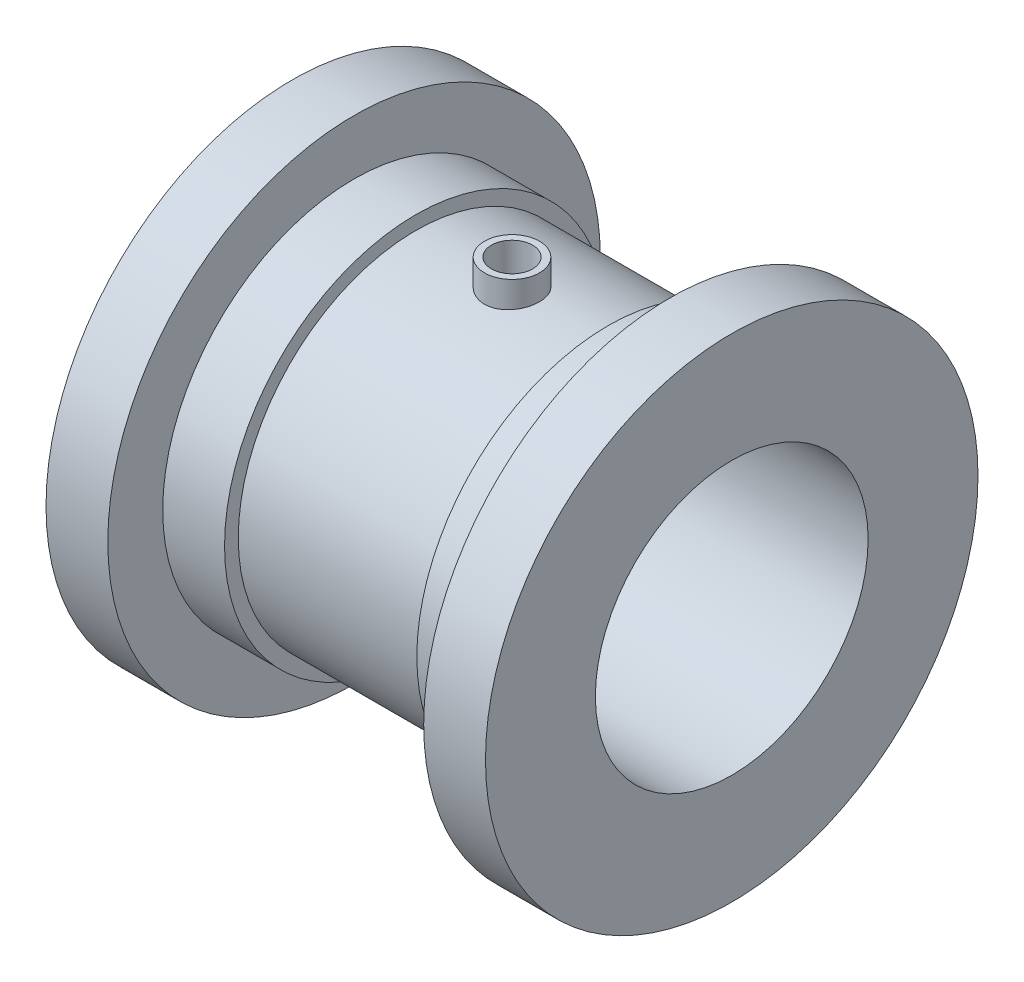
from build123d import *

# Parameters (mm, degrees)
CUT_EXTRUDE1_DEPTH       = 61.261789517
CUT_EXTRUDE1_DEPTH_BACK  = 61.261789517
SKETCH2_R                = 3
BOSS_EXTRUDE1_REACH      = 83.135
BOSS_EXTRUDE1_END_RADIUS = 25.86032094
SKETCH3_R                = 4
SKETCH3_R_2              = 3


with BuildPart() as part:
    # Sketch1 → Revolve1 (revolve)
    with BuildSketch(Plane.XY, mode=Mode.PRIVATE) as revolve1_sk:
        Polygon((-32, 20.352725591), (32, 20.352725591), (32, 36.352725591), (23, 36.352725591), (23, 28.352725591), (14, 28.352725591), (14, 26.352725591), (-14, 26.352725591), (-14, 28.352725591), (-23, 28.352725591), (-23, 36.352725591), (-32, 36.352725591), align=None)
    revolve(revolve1_sk.sketch.rotate(Axis((-45.635800038, 0.492404651, 0), (1, 0, 0)), 90), axis=Axis((-45.635800038, 0.492404651, 0), (1, 0, 0)))

    # Sketch2 → Cut-Extrude1 (cut, two sides: drawn at the far end of the back side and taken through both)
    with BuildSketch(Plane(origin=(0, 0, 0), x_dir=(1, 0, 0), z_dir=(0, 1, 0)).offset(-CUT_EXTRUDE1_DEPTH_BACK)):
        with Locations(Location((0, 0, 0), (0, 0, 270))):
            Circle(SKETCH2_R)
    extrude(amount=CUT_EXTRUDE1_DEPTH + CUT_EXTRUDE1_DEPTH_BACK, mode=Mode.SUBTRACT)

    # Boss-Extrude1: up to this cylinder (the profile starts outside it)
    boss_extrude1_end = Plane(origin=(0, 0.492404651, 0), z_dir=(-1, 0, 0)) * Cylinder(BOSS_EXTRUDE1_END_RADIUS, 218.99064188, mode=Mode.PRIVATE)
    # Sketch3 → Boss-Extrude1 (add, up to the surface)
    with BuildSketch(Plane(origin=(0, 30, 0), x_dir=(1, 0, 0), z_dir=(0, 1, 0)), mode=Mode.PRIVATE) as boss_extrude1_sk1:
        with Locations(Location((0, 0, 0), (0, 0, 270))):
            Circle(SKETCH3_R)
        with Locations(Location((0, 0, 0), (0, 0, 270))):
            Circle(SKETCH3_R_2, mode=Mode.SUBTRACT)
    boss_extrude1_tool1 = extrude(boss_extrude1_sk1.sketch, amount=-BOSS_EXTRUDE1_REACH, mode=Mode.PRIVATE) - boss_extrude1_end
    add(boss_extrude1_tool1.solids().sort_by_distance((0, 30, -3.886863))[0])


solid = part.part
